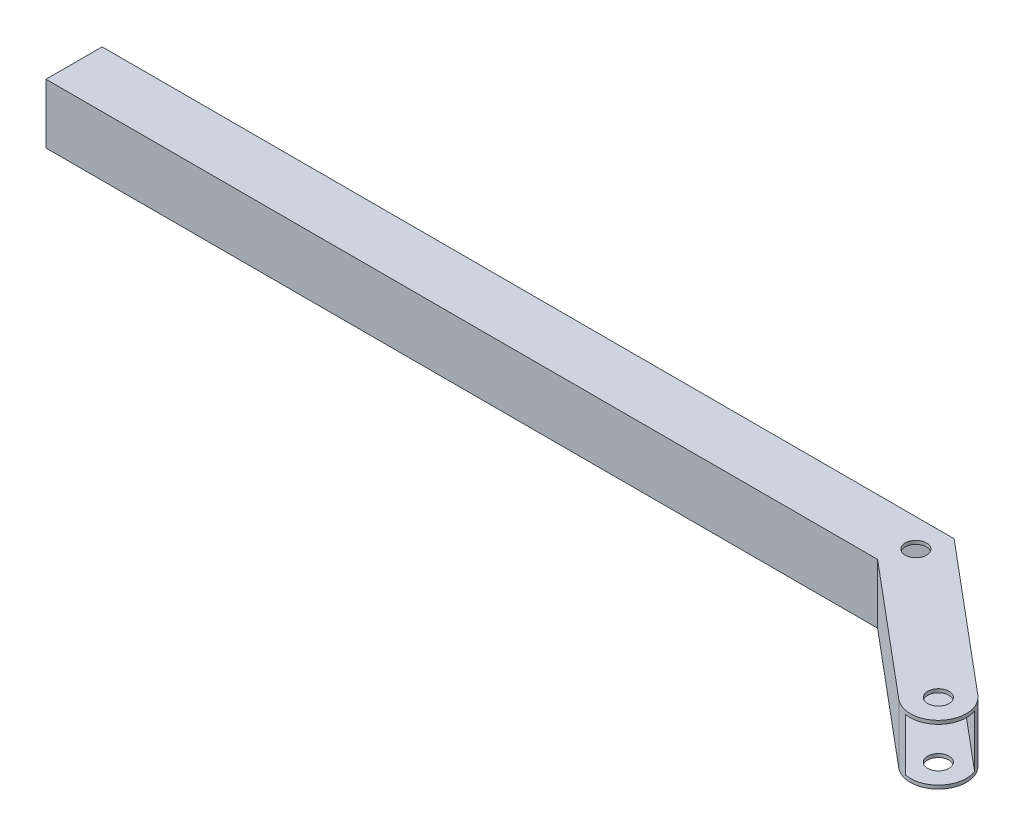
from build123d import *

# Parameters (mm, degrees)
BOSS_EXTRUDE1_DEPTH = 1.5875
BOSS_EXTRUDE2_DEPTH = 25.4
BOSS_EXTRUDE3_START = -1.5875
BOSS_EXTRUDE3_DEPTH = 1.5875
SKETCH4_R           = 4.826
CUT_EXTRUDE1_DEPTH  = 55.9435


with BuildPart() as part:
    # Sketch1 → Boss-Extrude1 (new body)
    with BuildSketch(Plane(origin=(0, 0, 0), x_dir=(1, 0, 0), z_dir=(0, 1, 0))):
        with BuildLine():
            Line((-385.622421975, -25.4), (-9.24484395, -25.4))
            Line((-9.24484395, -25.4), (50.451144161, -75.490881607))
            ThreePointArc((50.451144161, -75.490881607), (68.343311232, -73.925519823), (66.777949447, -56.033352752))
            Line((66.777949447, -56.033352752), (0, 0))
            Line((0, 0), (-385.622421975, 0))
            Line((-385.622421975, 0), (-385.622421975, -25.4))
        make_face()
    extrude(amount=BOSS_EXTRUDE1_DEPTH)

    # Sketch2 → Boss-Extrude2 (add)
    with BuildSketch(Plane(origin=(0, 1.5875, 0), x_dir=(1, 0, 0), z_dir=(0, 1, 0))):
        with BuildLine():
            Line((-385.622421975, 0), (-385.622421975, -1.5875))
            Line((-385.622421975, -1.5875), (-1.332070664, -1.5875))
            Line((-1.332070664, -1.5875), (-1.02042533, -1.216095553))
            Line((-1.02042533, -1.216095553), (-0.577802747, -1.5875))
            Line((-0.577802747, -1.5875), (0, -1.5875))
            Line((0, -1.5875), (0, -2.072334072))
            Line((0, -2.072334072), (70.467441943, -61.201538616))
            ThreePointArc((70.467441943, -61.201538616), (68.950918532, -58.383132189), (66.777949447, -56.033352752))
            Line((66.777949447, -56.033352752), (0, 0))
            Line((0, 0), (-385.622421975, 0))
        make_face()
        with BuildLine():
            Line((-8.667041203, -23.8125), (-385.622421975, -23.8125))
            Line((-385.622421975, -23.8125), (-385.622421975, -25.4))
            Line((-385.622421975, -25.4), (-9.24484395, -25.4))
            Line((-9.24484395, -25.4), (50.451144161, -75.490881607))
            ThreePointArc((50.451144161, -75.490881607), (53.14255729, -77.222803492), (56.181487318, -78.226876364))
            Line((56.181487318, -78.226876364), (-8.667041203, -23.8125))
        make_face()
    extrude(amount=BOSS_EXTRUDE2_DEPTH)

    # Sketch3 → Boss-Extrude3 (add)
    with BuildSketch(Plane(origin=(0, 26.9875, 0), x_dir=(1, 0, 0), z_dir=(0, 1, 0)).offset(BOSS_EXTRUDE3_START)):
        with BuildLine():
            Line((-385.622421975, 0), (-385.622421975, -25.4))
            Line((-385.622421975, -25.4), (-9.24484395, -25.4))
            Line((-9.24484395, -25.4), (50.451144161, -75.490881607))
            ThreePointArc((50.451144161, -75.490881607), (68.343311232, -73.925519823), (66.777949447, -56.033352752))
            Line((66.777949447, -56.033352752), (0, 0))
            Line((0, 0), (-385.622421975, 0))
        make_face()
    extrude(amount=BOSS_EXTRUDE3_DEPTH)

    # Sketch4 → Cut-Extrude1 (cut)
    with BuildSketch(Plane(origin=(0, 26.9875, 0), x_dir=(1, 0, 0), z_dir=(0, 1, 0))):
        with Locations(Location((58.614546804, -65.76211718, 0), (0, 0, 270))):
            Circle(SKETCH4_R)
        with Locations(Location((-4.622421975, -12.7, 0), (0, 0, 270))):
            Circle(SKETCH4_R)
    extrude(amount=-CUT_EXTRUDE1_DEPTH, mode=Mode.SUBTRACT)


solid = part.part
